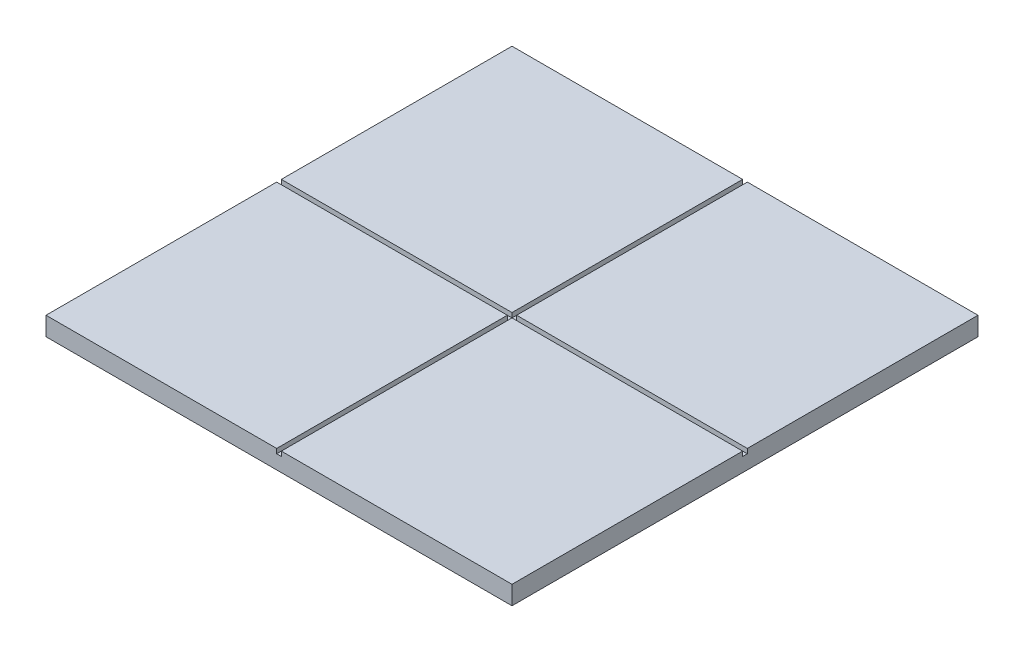
from build123d import *

# Parameters (mm, degrees)
SKETCH1_W           = 50
SKETCH1_H           = 50
BOSS_EXTRUDE1_DEPTH = 2
SKETCH2_W           = 0.5
SKETCH2_H           = 50
SKETCH2_W_2         = 50
SKETCH2_H_2         = 0.5
CUT_EXTRUDE1_DEPTH  = 0.5


with BuildPart() as part:
    # Sketch1 → Boss-Extrude1 (new body)
    with BuildSketch(Plane(origin=(0, 0, 0), x_dir=(1, 0, 0), z_dir=(0, 1, 0))):
        with Locations((25, 25)):
            Rectangle(SKETCH1_W, SKETCH1_H)
    extrude(amount=BOSS_EXTRUDE1_DEPTH)

    # Sketch2 → Cut-Extrude1 (cut)
    with BuildSketch(Plane(origin=(0, 2, 0), x_dir=(1, 0, 0), z_dir=(0, 1, 0))):
        with Locations((25, 25)):
            Rectangle(SKETCH2_W, SKETCH2_H)
        with Locations((25, 25)):
            Rectangle(SKETCH2_W_2, SKETCH2_H_2)
    extrude(amount=-CUT_EXTRUDE1_DEPTH, mode=Mode.SUBTRACT)


solid = part.part
